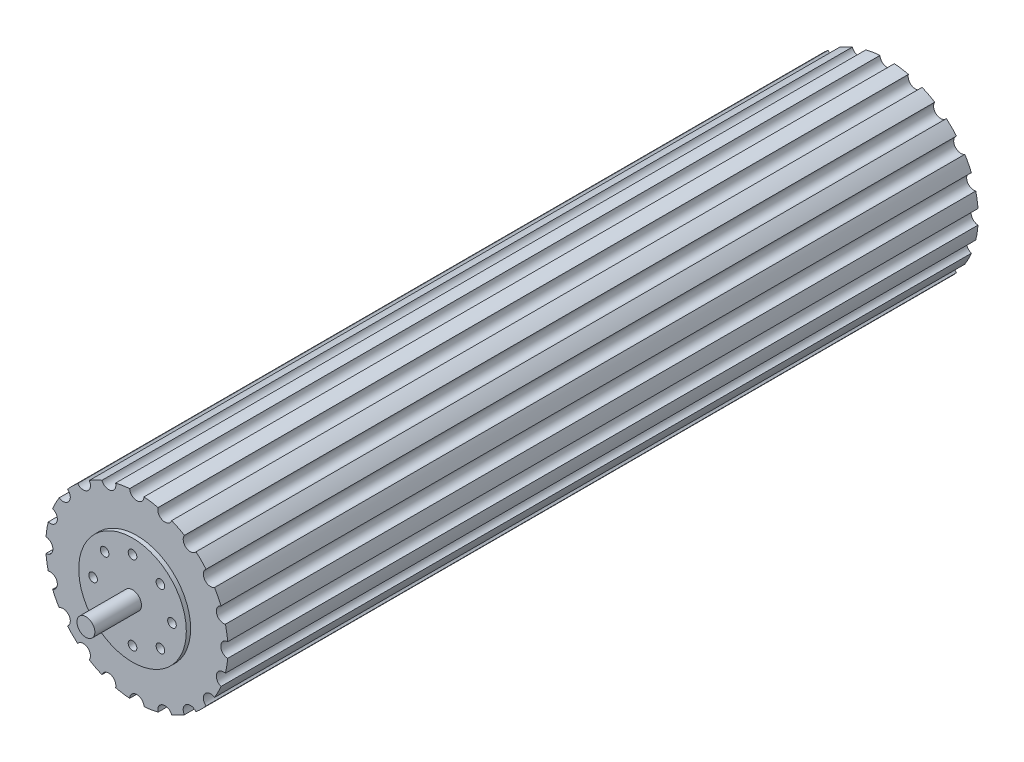
from build123d import *

# Parameters (mm, degrees)
SKETCH1_R               = 127
SKETCH1_R_2             = 12.5
BOSS_EXTRUDE1_DEPTH     = 1046
SKETCH3_R               = 12.5
BOSS_EXTRUDE2_DEPTH     = 584
BOSS_EXTRUDE4_START     = 6
SKETCH4_R               = 75
SKETCH4_R_2             = 12.5
BOSS_EXTRUDE4_DEPTH     = 6
SKETCH6_R               = 75
BOSS_EXTRUDE5_DEPTH     = 6
CUT_EXTRUDE1_DEPTH      = 1138.271735339
CUT_EXTRUDE1_DEPTH_BACK = 1138.271735339
SKETCH7_R               = 6
CUT_EXTRUDE2_DEPTH      = 1132.347426744
CUT_EXTRUDE2_DEPTH_BACK = 1132.347426744
SKETCH8_R               = 10


with BuildPart() as part:
    # Sketch1 → Boss-Extrude1 (new body)
    with BuildSketch(Plane.XY):
        Circle(SKETCH1_R)
        Circle(SKETCH1_R_2, mode=Mode.SUBTRACT)
    extrude(amount=BOSS_EXTRUDE1_DEPTH)

    # Sketch3 → Boss-Extrude2 (add, symmetric)
    with BuildSketch(Plane.XY.offset(533)):
        Circle(SKETCH3_R)
    extrude(amount=BOSS_EXTRUDE2_DEPTH, both=True)

    # Sketch4 → Boss-Extrude4 (add)
    with BuildSketch(Plane.XY.offset(1046).offset(BOSS_EXTRUDE4_START)):
        Circle(SKETCH4_R)
        Circle(SKETCH4_R_2, mode=Mode.SUBTRACT)
    extrude(amount=-BOSS_EXTRUDE4_DEPTH)

    # Sketch6 → Boss-Extrude5 (add)
    with BuildSketch(Plane(origin=(0, 0, 0), x_dir=(-1, 0, 0), z_dir=(0, 0, -1))):
        with Locations(Location((0, 0, 0), (0, 0, 180))):
            Circle(SKETCH6_R)
    extrude(amount=BOSS_EXTRUDE5_DEPTH)

    # Sketch7 → Cut-Extrude1 (cut, two sides: drawn at the far end of the back side and taken through both)
    with BuildSketch(Plane(origin=(0, 0, -6), x_dir=(-1, 0, 0), z_dir=(0, 0, -1)).offset(-CUT_EXTRUDE1_DEPTH_BACK)):
        with Locations((0, 55)):
            Circle(SKETCH7_R)
        with Locations((38.890872965, 38.890872965)):
            Circle(SKETCH7_R)
        with Locations((55, 0)):
            Circle(SKETCH7_R)
        with Locations((38.890872965, -38.890872965)):
            Circle(SKETCH7_R)
        with Locations((0, -55)):
            Circle(SKETCH7_R)
        with Locations((-38.890872965, -38.890872965)):
            Circle(SKETCH7_R)
        with Locations((-55, 0)):
            Circle(SKETCH7_R)
        with Locations((-38.890872965, 38.890872965)):
            Circle(SKETCH7_R)
    extrude(amount=CUT_EXTRUDE1_DEPTH + CUT_EXTRUDE1_DEPTH_BACK, mode=Mode.SUBTRACT)

    # Sketch8 → Cut-Extrude2 (cut, two sides: drawn at the far end of the back side and taken through both)
    with BuildSketch(Plane(origin=(0, 0, 0), x_dir=(-1, 0, 0), z_dir=(0, 0, -1)).offset(-CUT_EXTRUDE2_DEPTH_BACK)):
        with Locations((0, 127)):
            Circle(SKETCH8_R)
        with Locations((39.245158286, 120.784177569)):
            Circle(SKETCH8_R)
        with Locations((74.648727041, 102.745158286)):
            Circle(SKETCH8_R)
        with Locations((102.745158286, 74.648727041)):
            Circle(SKETCH8_R)
        with Locations((120.784177569, 39.245158286)):
            Circle(SKETCH8_R)
        with Locations((127, 0)):
            Circle(SKETCH8_R)
        with Locations((120.784177569, -39.245158286)):
            Circle(SKETCH8_R)
        with Locations((102.745158286, -74.648727041)):
            Circle(SKETCH8_R)
        with Locations((74.648727041, -102.745158286)):
            Circle(SKETCH8_R)
        with Locations((39.245158286, -120.784177569)):
            Circle(SKETCH8_R)
        with Locations((0, -127)):
            Circle(SKETCH8_R)
        with Locations((-39.245158286, -120.784177569)):
            Circle(SKETCH8_R)
        with Locations((-74.648727041, -102.745158286)):
            Circle(SKETCH8_R)
        with Locations((-102.745158286, -74.648727041)):
            Circle(SKETCH8_R)
        with Locations((-120.784177569, -39.245158286)):
            Circle(SKETCH8_R)
        with Locations((-127, 0)):
            Circle(SKETCH8_R)
        with Locations((-120.784177569, 39.245158286)):
            Circle(SKETCH8_R)
        with Locations((-102.745158286, 74.648727041)):
            Circle(SKETCH8_R)
        with Locations((-74.648727041, 102.745158286)):
            Circle(SKETCH8_R)
        with Locations((-39.245158286, 120.784177569)):
            Circle(SKETCH8_R)
    extrude(amount=CUT_EXTRUDE2_DEPTH + CUT_EXTRUDE2_DEPTH_BACK, mode=Mode.SUBTRACT)


solid = part.part
